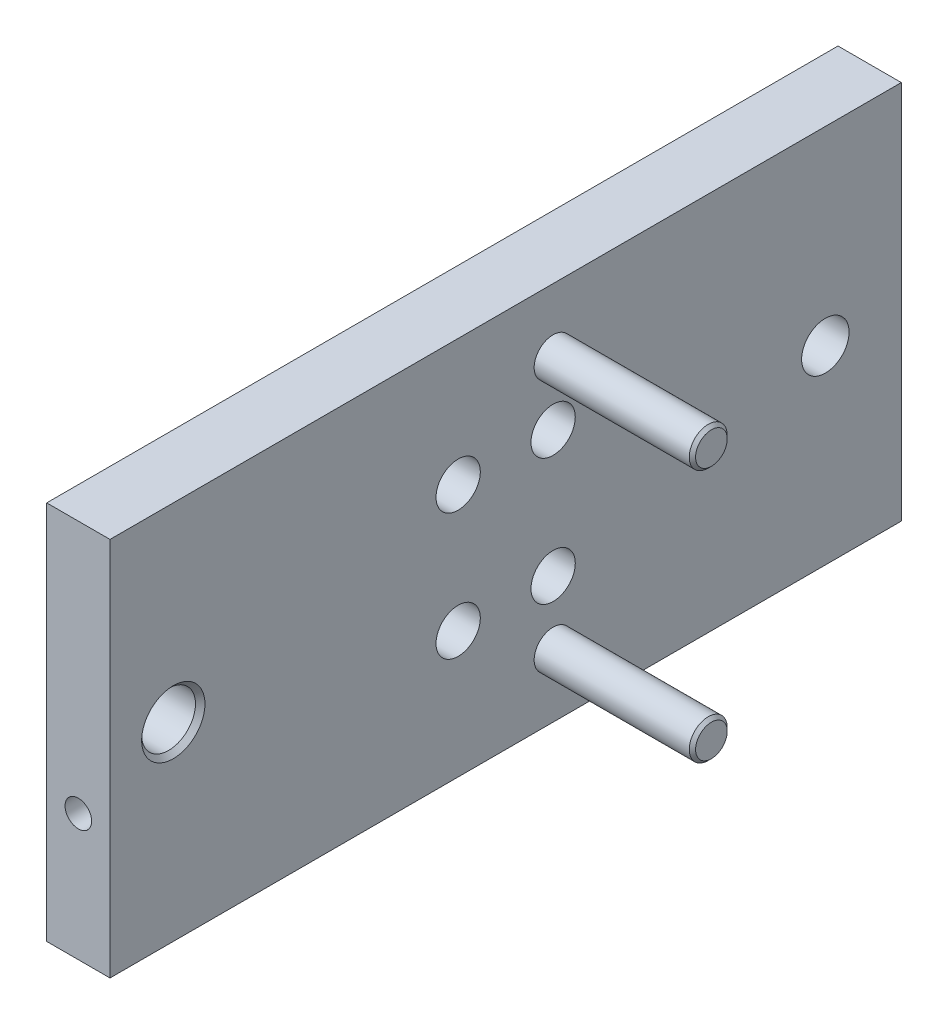
from build123d import *

# Parameters (mm, degrees)
SKETCH1_W                                           = 125
SKETCH1_H                                           = 60
BOSS_EXTRUDE1_DEPTH                                 = 10
SKETCH12_R                                          = 3
BOSS_EXTRUDE2_DEPTH                                 = 25
M10_TAPPED_HOLE1_D                                  = 8.5
M10_TAPPED_HOLE1_DEPTH                              = 24.5
M10_TAPPED_HOLE1_CSINK_D                            = 10
M10_TAPPED_HOLE1_CSINK_ANGLE                        = 90
M10_TAPPED_HOLE1_TIP                                = 2.553657631
SKETCH7_R                                           = 3.75
CUT_EXTRUDE1_DEPTH                                  = 141.890028036
CBORE_FOR_M3_HEX_SOCKET_HEAD_CAP_SCREW1_D           = 3.4
CBORE_FOR_M3_HEX_SOCKET_HEAD_CAP_SCREW1_CBORE_D     = 7
CBORE_FOR_M3_HEX_SOCKET_HEAD_CAP_SCREW1_CBORE_DEPTH = 5
M5_TAPPED_HOLE1_D                                   = 4.2
M5_TAPPED_HOLE1_DEPTH                               = 12.4
M5_TAPPED_HOLE1_TIP                                 = 1.2618073
CHAMFER2_SIZE                                       = 0.5


with BuildPart() as part:
    # Sketch1 → Boss-Extrude1 (new body)
    with BuildSketch(Plane(origin=(0, 0, 0), x_dir=(0, 0, -1), z_dir=(1, 0, 0))):
        with Locations((-62.5, 30)):
            Rectangle(SKETCH1_W, SKETCH1_H)
    extrude(amount=BOSS_EXTRUDE1_DEPTH)

    # Sketch12 → Boss-Extrude2 (add)
    with BuildSketch(Plane(origin=(10, 0, 0), x_dir=(0, 0, -1), z_dir=(1, 0, 0))):
        with Locations((-55, 10)):
            Circle(SKETCH12_R)
        with Locations((-55, 50)):
            Circle(SKETCH12_R)
    extrude(amount=BOSS_EXTRUDE2_DEPTH)

    # M10 Tapped Hole1
    with Locations(Plane(origin=(10, 0, 0), x_dir=(0, 0, -1), z_dir=(1, 0, 0))):
        with Locations((-115, 30)):
            CounterSinkHole(M10_TAPPED_HOLE1_D / 2, M10_TAPPED_HOLE1_CSINK_D / 2, depth=M10_TAPPED_HOLE1_DEPTH, counter_sink_angle=M10_TAPPED_HOLE1_CSINK_ANGLE)
            with Locations((0, 0, -(M10_TAPPED_HOLE1_DEPTH + M10_TAPPED_HOLE1_TIP / 2))):  # 118° drill point
                Cone(0, M10_TAPPED_HOLE1_D / 2, M10_TAPPED_HOLE1_TIP, mode=Mode.SUBTRACT)

    # Sketch7 → Cut-Extrude1 (cut, through all)
    with BuildSketch(Plane(origin=(10, 0, 0), x_dir=(0, 0, -1), z_dir=(1, 0, 0))):
        with Locations((-12, 30)):
            Circle(SKETCH7_R)
    extrude(amount=-CUT_EXTRUDE1_DEPTH, mode=Mode.SUBTRACT)

    # CBORE for M3 Hex Socket Head Cap Screw1 (through all)
    with Locations(Plane(origin=(10, 0, 0), x_dir=(0, 0, -1), z_dir=(1, 0, 0))):
        with Locations((-70, 20), (-55, 20), (-55, 40), (-70, 40)):
            CounterBoreHole(CBORE_FOR_M3_HEX_SOCKET_HEAD_CAP_SCREW1_D / 2, CBORE_FOR_M3_HEX_SOCKET_HEAD_CAP_SCREW1_CBORE_D / 2, CBORE_FOR_M3_HEX_SOCKET_HEAD_CAP_SCREW1_CBORE_DEPTH)

    # M5 Tapped Hole1
    with Locations(Plane.XY.offset(125)):
        with Locations((5, 20)):
            Hole(M5_TAPPED_HOLE1_D / 2, depth=M5_TAPPED_HOLE1_DEPTH)
            with Locations((0, 0, -(M5_TAPPED_HOLE1_DEPTH + M5_TAPPED_HOLE1_TIP / 2))):  # 118° drill point
                Cone(0, M5_TAPPED_HOLE1_D / 2, M5_TAPPED_HOLE1_TIP, mode=Mode.SUBTRACT)

    # Chamfer2
    chamfer2_edges = [part.edges().sort_by_distance(p)[0] for p in [
        (35, 10, 58),
        (35, 50, 58),
    ]]
    chamfer(chamfer2_edges, length=CHAMFER2_SIZE)


solid = part.part
